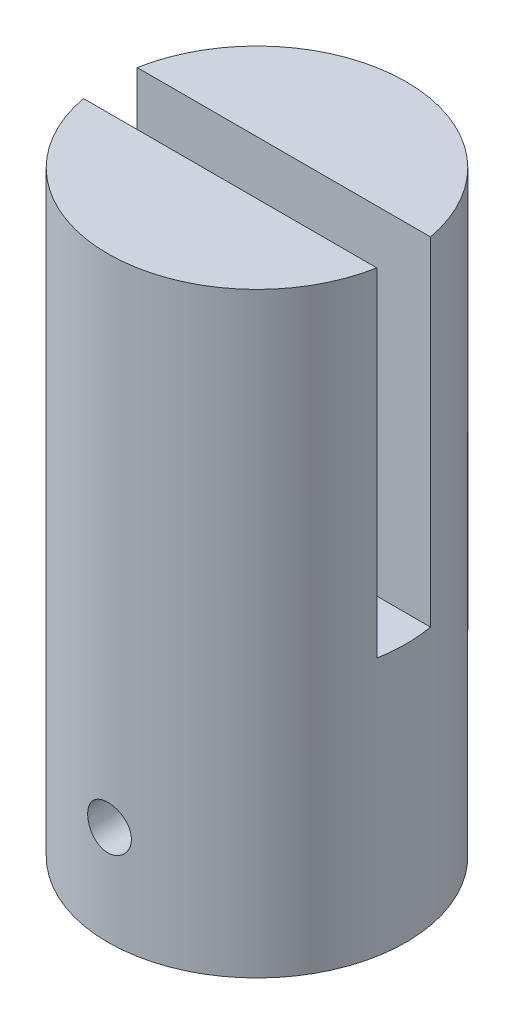
from build123d import *

# Parameters (mm, degrees)
SKETCH1_R               = 7.5
SKETCH1_R_2             = 3.075
BOSS_EXTRUDE1_DEPTH     = 10
BOSS_EXTRUDE2_START     = 20
SKETCH1_3_R             = 7.5
BOSS_EXTRUDE2_DEPTH     = 20
CUT_EXTRUDE1_DEPTH      = 17
CUT_EXTRUDE2_DEPTH      = 23.638462845
CUT_EXTRUDE2_DEPTH_BACK = 23.638462845
SKETCH3_R               = 1.1


with BuildPart() as part:
    # Sketch1 → Boss-Extrude1 (new body)
    with BuildSketch(Plane(origin=(0, 0, 0), x_dir=(1, 0, 0), z_dir=(0, 1, 0))):
        Circle(SKETCH1_R)
        Circle(SKETCH1_R_2, mode=Mode.SUBTRACT)
    extrude(amount=-BOSS_EXTRUDE1_DEPTH)

    # Sketch1<3> → Boss-Extrude2 (add)
    with BuildSketch(Plane(origin=(0, 0, 0), x_dir=(1, 0, 0), z_dir=(0, 1, 0)).offset(BOSS_EXTRUDE2_START)):
        Circle(SKETCH1_3_R)
    extrude(amount=-BOSS_EXTRUDE2_DEPTH)

    # Sketch2 → Cut-Extrude1 (cut)
    with BuildSketch(Plane(origin=(0, 20, 0), x_dir=(1, 0, 0), z_dir=(0, 1, 0))):
        with BuildLine():
            Line((-7.377499576, 1.35), (7.377499576, 1.35))
            ThreePointArc((7.377499576, 1.35), (7.5, 0), (7.377499576, -1.35))
            Line((7.377499576, -1.35), (-7.377499576, -1.35))
            ThreePointArc((-7.377499576, -1.35), (-7.5, 0), (-7.377499576, 1.35))
        make_face()
    extrude(amount=-CUT_EXTRUDE1_DEPTH, mode=Mode.SUBTRACT)

    # Sketch3 → Cut-Extrude2 (cut, two sides: drawn at the far end of the back side and taken through both)
    with BuildSketch(Plane.XY.offset(-CUT_EXTRUDE2_DEPTH_BACK)):
        with Locations((0, -5)):
            Circle(SKETCH3_R)
    extrude(amount=CUT_EXTRUDE2_DEPTH + CUT_EXTRUDE2_DEPTH_BACK, mode=Mode.SUBTRACT)


solid = part.part
